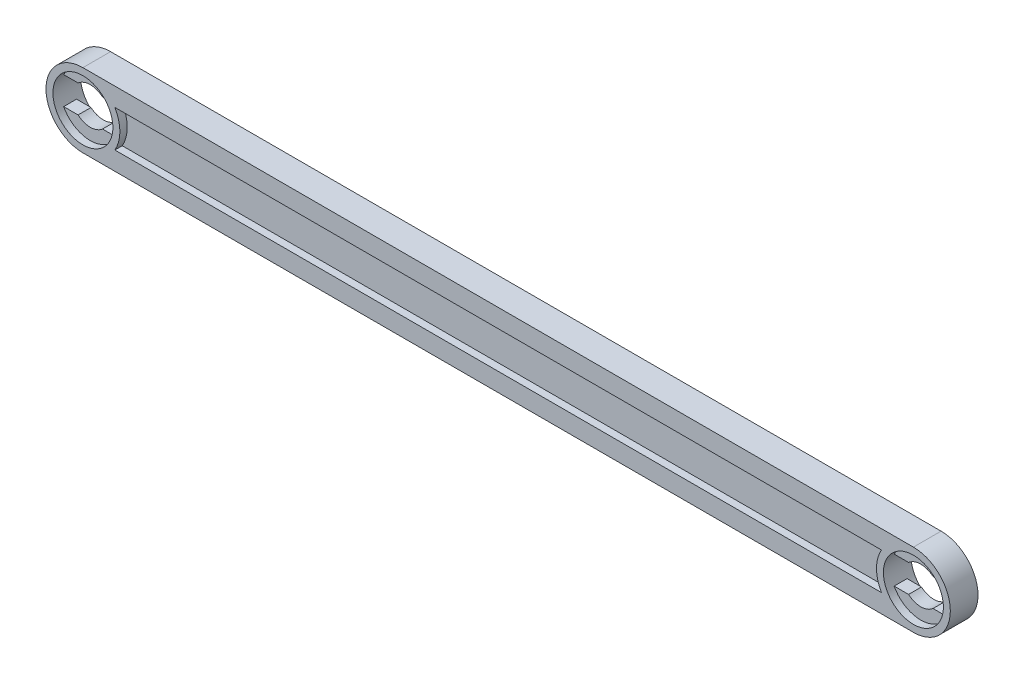
from build123d import *

# Parameters (mm, degrees)
EXTRUDE_1_DEPTH     = 3
CUT_EXTRUDE_1_REACH = 96.133
SKETCH_3_R          = 3.25
CUT_EXTRUDE_2_DEPTH = 0.8
CUT_EXTRUDE_START   = -2.2
SKETCH_3_2_R        = 3.25
CUT_EXTRUDE_3_DEPTH = 0.8
CUT_EXTRUDE_4_DEPTH = 0.8
SKETCH_5_W          = 82
SKETCH_5_H          = 4
CUT_EXTRUDE_5_DEPTH = 0.8


with BuildPart() as part:
    # 草图1 → 凸台-拉伸1 (new body)
    with BuildSketch(Plane.XY):
        with BuildLine():
            Line((0, 4), (90, 4))
            ThreePointArc((90, 4), (94, 0), (90, -4))
            Line((90, -4), (0, -4))
            ThreePointArc((0, -4), (-4, 0), (0, 4))
        make_face()
    extrude(amount=-EXTRUDE_1_DEPTH)

    # 草图2 → 切除-拉伸1 (cut, up to next)
    with BuildSketch(Plane.XY, mode=Mode.PRIVATE) as cut_extrude_1_sk1:
        with BuildLine():
            Line((1.322875656, -1.5), (2.883140649, -1.5))
            ThreePointArc((2.883140649, -1.5), (3.25, 0), (2.883140649, 1.5))
            Line((2.883140649, 1.5), (1.322875656, 1.5))
            ThreePointArc((1.322875656, 1.5), (0, 2), (-1.322875656, 1.5))
            Line((-1.322875656, 1.5), (-2.883140649, 1.5))
            ThreePointArc((-2.883140649, 1.5), (-3.25, 0), (-2.883140649, -1.5))
            Line((-2.883140649, -1.5), (-1.322875656, -1.5))
            ThreePointArc((-1.322875656, -1.5), (0, -2), (1.322875656, -1.5))
        make_face()
    cut_extrude_1_tool1 = extrude(cut_extrude_1_sk1.sketch, amount=-CUT_EXTRUDE_1_REACH, mode=Mode.PRIVATE) & part.part
    cut_extrude_1 = cut_extrude_1_tool1.solids().sort_by_distance((0, 0, 0))[0]
    add(cut_extrude_1, mode=Mode.SUBTRACT)

    # 草图3 → 切除-拉伸2 (cut)
    with BuildSketch(Plane.XY):
        Circle(SKETCH_3_R)
    cut_extrude_2 = extrude(amount=-CUT_EXTRUDE_2_DEPTH, mode=Mode.SUBTRACT)

    # 草图3<2> → 切除-拉伸3 (cut)
    with BuildSketch(Plane.XY.offset(CUT_EXTRUDE_START)):
        Circle(SKETCH_3_2_R)
    cut_extrude_3 = extrude(amount=-CUT_EXTRUDE_3_DEPTH, mode=Mode.SUBTRACT)

    # 镜向1: 切除-拉伸1, 切除-拉伸2, 切除-拉伸3 across plane
    add(cut_extrude_1.mirror(Plane(origin=(45, 0, 0), x_dir=(0, 0, 1), z_dir=(1, 0, 0))), mode=Mode.SUBTRACT)
    add(cut_extrude_2.mirror(Plane(origin=(45, 0, 0), x_dir=(0, 0, 1), z_dir=(1, 0, 0))), mode=Mode.SUBTRACT)
    add(cut_extrude_3.mirror(Plane(origin=(45, 0, 0), x_dir=(0, 0, 1), z_dir=(1, 0, 0))), mode=Mode.SUBTRACT)

    # 草图4 → 切除-拉伸4 (cut)
    with BuildSketch(Plane.XY):
        with BuildLine():
            Line((3.464101615, 2), (86.535898385, 2))
            ThreePointArc((86.535898385, 2), (86, 0), (86.535898385, -2))
            Line((86.535898385, -2), (3.464101615, -2))
            ThreePointArc((3.464101615, -2), (4, 0), (3.464101615, 2))
        make_face()
    extrude(amount=-CUT_EXTRUDE_4_DEPTH, mode=Mode.SUBTRACT)

    # 草图5 → 切除-拉伸5 (cut)
    with BuildSketch(Plane(origin=(0, 0, -3), x_dir=(-1, 0, 0), z_dir=(0, 0, -1))):
        with Locations((-45, 0)):
            Rectangle(SKETCH_5_W, SKETCH_5_H)
    extrude(amount=-CUT_EXTRUDE_5_DEPTH, mode=Mode.SUBTRACT)


solid = part.part
